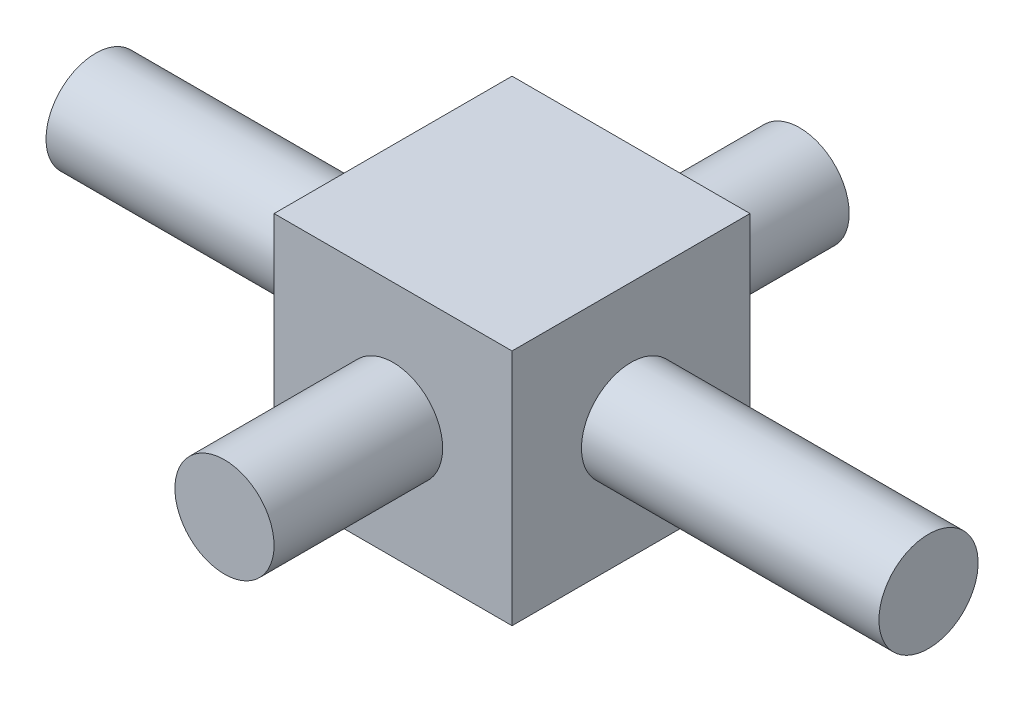
from build123d import *

# Parameters (mm, degrees)
SKETCH1_W    = 12
SKETCH1_H    = 12
NUCLEO_DEPTH = 12
SKETCH2_W    = 42
SKETCH2_H    = 2.5
SKETCH3_W    = 29
SKETCH3_H    = 2.5


with BuildPart() as part:
    # Sketch1 → Nucleo (new body)
    with BuildSketch(Plane.XY.offset(-6)):
        Rectangle(SKETCH1_W, SKETCH1_H)
    extrude(amount=NUCLEO_DEPTH)

    # Sketch2 → Eje_flexion (revolve)
    with BuildSketch(Plane.XY, mode=Mode.PRIVATE) as eje_flexion_sk:
        with Locations((0, 1.25)):
            Rectangle(SKETCH2_W, SKETCH2_H)
    revolve(eje_flexion_sk.sketch.rotate(Axis((-25, 0, 0), (1, 0, 0)), 90), axis=Axis((-25, 0, 0), (1, 0, 0)))

    # Sketch3 → Eje_desviacion (revolve)
    with BuildSketch(Plane(origin=(0, 0, 0), x_dir=(0, 0, -1), z_dir=(1, 0, 0)), mode=Mode.PRIVATE) as eje_desviacion_sk:
        with Locations((0, 1.25)):
            Rectangle(SKETCH3_W, SKETCH3_H)
    revolve(eje_desviacion_sk.sketch.rotate(Axis((0, 0, 18.5), (0, 0, -1)), 90), axis=Axis((0, 0, 18.5), (0, 0, -1)))


solid = part.part
